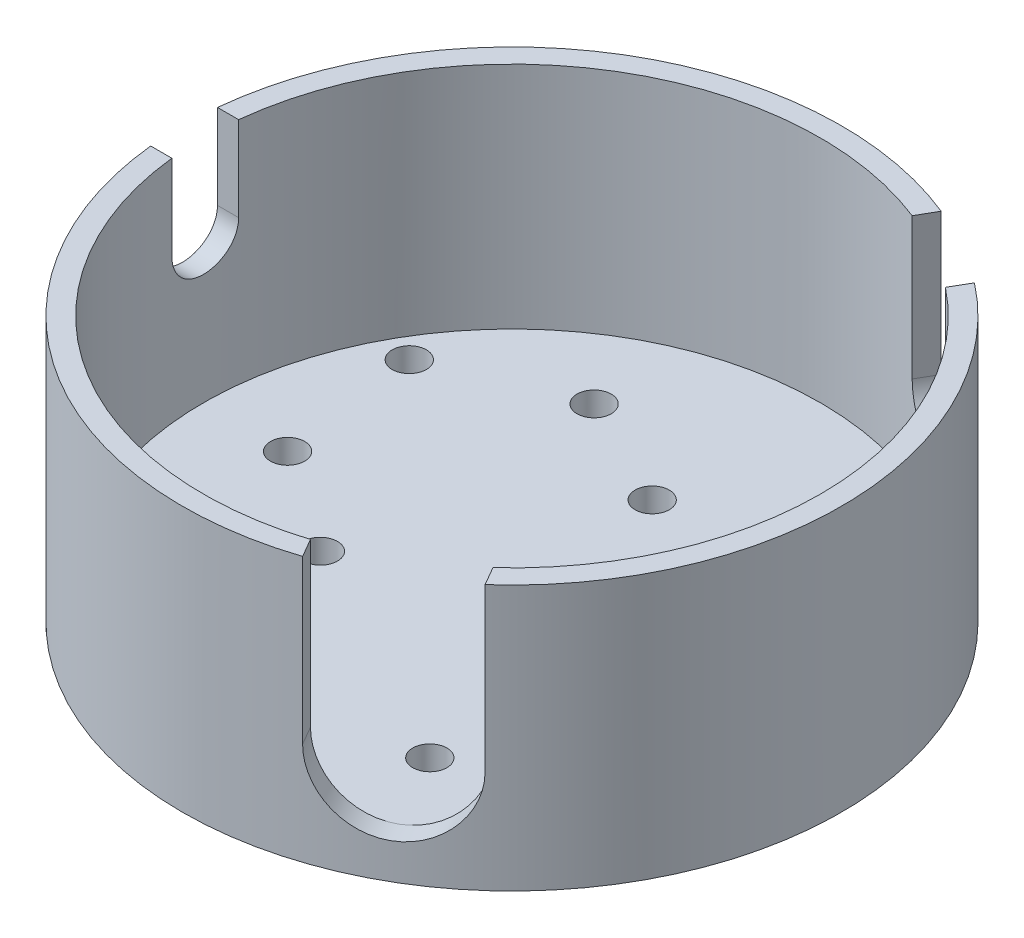
from build123d import *

# Parameters (mm, degrees)
SKETCH1_R             = 23.5
BOSS_EXTRUDE1_DEPTH   = 2.54
F_2_CLEARANCE_HOLE2_D = 2.4384
SKETCH4_R             = 23.5
SKETCH4_R_2           = 22
BOSS_EXTRUDE2_DEPTH   = 16.3576
F_2_CLEARANCE_HOLE1_D = 2.4384
SKETCH7_R             = 1.2192
SKETCH7_R_2           = 0.75
CUT_EXTRUDE1_DEPTH    = 39.2311298
CUT_EXTRUDE2_DEPTH    = 10
CUT_EXTRUDE3_DEPTH    = 10
CUT_EXTRUDE4_DEPTH    = 10


with BuildPart() as part:
    # Sketch1 → Boss-Extrude1 (new body)
    with BuildSketch(Plane(origin=(0, 0, 0), x_dir=(1, 0, 0), z_dir=(0, 1, 0))):
        with Locations(Location((0, 0, 0), (0, 0, 270))):
            Circle(SKETCH1_R)
    extrude(amount=BOSS_EXTRUDE1_DEPTH)

    # #2 Clearance Hole2 (through all)
    with Locations(Plane(origin=(0, 2.54, -10), x_dir=(0, 0, 1), z_dir=(0, 1, 0))):
        with Locations((0, 0), (15, 8.660254038), (15, -8.660254038)):
            Hole(F_2_CLEARANCE_HOLE2_D / 2)

    # Sketch4 → Boss-Extrude2 (add)
    with BuildSketch(Plane(origin=(0, 2.54, 0), x_dir=(1, 0, 0), z_dir=(0, 1, 0))):
        with Locations(Location((0, 0, 0), (0, 0, 270))):
            Circle(SKETCH4_R)
        with Locations(Location((0, 0, 0), (0, 0, 270))):
            Circle(SKETCH4_R_2, mode=Mode.SUBTRACT)
    extrude(amount=BOSS_EXTRUDE2_DEPTH)

    # #2 Clearance Hole1 (through all)
    with Locations(Plane(origin=(0, 0, 20), x_dir=(0, 0, -1), z_dir=(0, -1, 0))):
        with Locations((0, 0), (30, 17.320508076), (30, -17.320508076)):
            Hole(F_2_CLEARANCE_HOLE1_D / 2)

    # Sketch7 → Cut-Extrude1 (cut, through all)
    with BuildSketch(Plane.XZ):
        with Locations(Location((-8, 13.856406461, 0), (0, 0, 270))):
            Circle(SKETCH7_R)
        with Locations(Location((8.0005, 13.857272486, 0), (0, 0, 270))):
            Circle(SKETCH7_R)
        with Locations(Location((16.0015, 0.000866025, 0), (0, 0, 270))):
            Circle(SKETCH7_R)
        with Locations(Location((8.002, -13.856406461, 0), (0, 0, 270))):
            Circle(SKETCH7_R)
        with Locations(Location((-7.9985, -13.857272486, 0), (0, 0, 270))):
            Circle(SKETCH7_R)
        with Locations(Location((-15.9995, -0.000866025, 0), (0, 0, 270))):
            Circle(SKETCH7_R)
        with Locations(Location((0, 0, 0), (0, 0, 270))):
            Circle(SKETCH7_R_2)
    extrude(amount=-CUT_EXTRUDE1_DEPTH, mode=Mode.SUBTRACT)

    # Sketch9 → Cut-Extrude2 (cut)
    with BuildSketch(Plane(origin=(11.75, 0, 20.351596989), x_dir=(0.866025403784438, 0, -0.5000000000000012), z_dir=(0.5000000000000011, 0, 0.8660254037844379))):
        with BuildLine():
            Line((-4.7625, 7.3025), (-4.7625, 18.8976))
            Line((-4.7625, 18.8976), (4.7625, 18.8976))
            Line((4.7625, 18.8976), (4.7625, 7.3025))
            ThreePointArc((4.7625, 7.3025), (0, 2.54), (-4.7625, 7.3025))
        make_face()
    extrude(amount=-CUT_EXTRUDE2_DEPTH, mode=Mode.SUBTRACT)

    # Sketch10 → Cut-Extrude3 (cut)
    with BuildSketch(Plane(origin=(11.75, 0, -20.351596989), x_dir=(-0.8660254037844415, 0, -0.49999999999999517), z_dir=(0.4999999999999951, 0, -0.8660254037844414))):
        with BuildLine():
            Line((-3.2385, 8.8138), (-3.2385, 18.8976))
            Line((-3.2385, 18.8976), (3.2385, 18.8976))
            Line((3.2385, 18.8976), (3.2385, 8.8138))
            ThreePointArc((3.2385, 8.8138), (0, 5.5753), (-3.2385, 8.8138))
        make_face()
    extrude(amount=-CUT_EXTRUDE3_DEPTH, mode=Mode.SUBTRACT)

    # Sketch11 → Cut-Extrude4 (cut)
    with BuildSketch(Plane.ZY.offset(23.5)):
        with BuildLine():
            Line((-2.38125, 12.84605), (-2.38125, 18.8976))
            Line((-2.38125, 18.8976), (2.38125, 18.8976))
            Line((2.38125, 18.8976), (2.38125, 12.84605))
            ThreePointArc((2.38125, 12.84605), (0, 10.4648), (-2.38125, 12.84605))
        make_face()
    extrude(amount=-CUT_EXTRUDE4_DEPTH, mode=Mode.SUBTRACT)


solid = part.part
